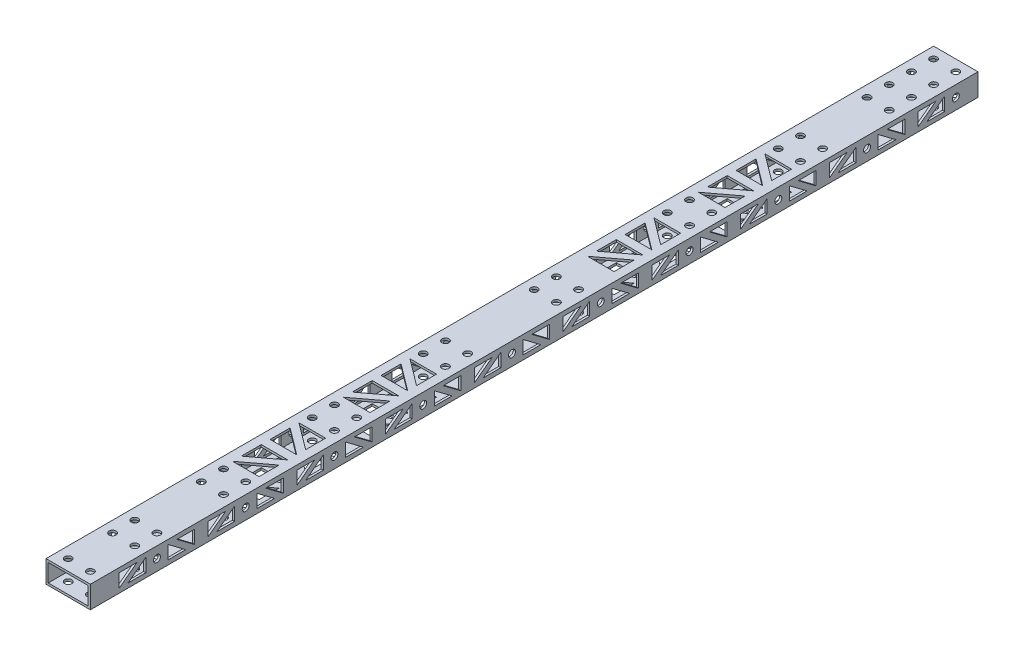
from build123d import *

# Parameters (mm, degrees)
SKETCH_1_W          = 20
SKETCH_1_H          = 10
SKETCH_1_W_2        = 18
SKETCH_1_H_2        = 8
EXTRUDE_1_DEPTH     = 400
SKETCH_2_R          = 1.575
CUT_EXTRUDE_1_DEPTH = 401.62451248
SKETCH_3_R          = 1.575
CUT_EXTRUDE_2_DEPTH = 10
SKETCH_4_R          = 1.575
CUT_EXTRUDE_3_DEPTH = 401.62451248


with BuildPart() as part:
    # 草图1 → 拉伸-薄壁1 (new body)
    with BuildSketch(Plane.XY):
        with Locations((10, -5)):
            Rectangle(SKETCH_1_W, SKETCH_1_H)
        with Locations((10, -5)):
            Rectangle(SKETCH_1_W_2, SKETCH_1_H_2, mode=Mode.SUBTRACT)
    extrude(amount=EXTRUDE_1_DEPTH)

    # 草图2 → 切除-拉伸1 (cut, through all)
    with BuildSketch(Plane(origin=(0, 0, 0), x_dir=(1, 0, 0), z_dir=(0, 1, 0))):
        with Locations(Location((15, -5, 0), (0, 0, 270))):
            Circle(SKETCH_2_R)
        with Locations(Location((5, -5, 0), (0, 0, 90))):
            Circle(SKETCH_2_R)
        with Locations(Location((5, -15, 0), (0, 0, 270))):
            Circle(SKETCH_2_R)
        with Locations(Location((15, -15, 0), (0, 0, 90))):
            Circle(SKETCH_2_R)
        with Locations(Location((15, -25, 0), (0, 0, 270))):
            Circle(SKETCH_2_R)
        with Locations(Location((5, -25, 0), (0, 0, 90))):
            Circle(SKETCH_2_R)
        with Locations(Location((5, -35, 0), (0, 0, 270))):
            Circle(SKETCH_2_R)
        with Locations(Location((15, -35, 0), (0, 0, 90))):
            Circle(SKETCH_2_R)
    extrude(amount=-CUT_EXTRUDE_1_DEPTH, mode=Mode.SUBTRACT)

    # 草图3 → 切除-拉伸2 (cut)
    with BuildSketch(Plane(origin=(0, 0, 0), x_dir=(1, 0, 0), z_dir=(0, 1, 0))):
        with Locations(Location((5, -395, 0), (0, 0, 270))):
            Circle(SKETCH_3_R)
        with Locations(Location((15, -395, 0), (0, 0, 90))):
            Circle(SKETCH_3_R)
        with Locations(Location((5, -375, 0), (0, 0, 270))):
            Circle(SKETCH_3_R)
        with Locations(Location((15, -375, 0), (0, 0, 90))):
            Circle(SKETCH_3_R)
        with Locations(Location((5, -365, 0), (0, 0, 270))):
            Circle(SKETCH_3_R)
        with Locations(Location((15, -365, 0), (0, 0, 90))):
            Circle(SKETCH_3_R)
        with Locations(Location((15, -335, 0), (0, 0, 270))):
            Circle(SKETCH_3_R)
        with Locations(Location((5, -335, 0), (0, 0, 90))):
            Circle(SKETCH_3_R)
        with Locations(Location((15, -325, 0), (0, 0, 270))):
            Circle(SKETCH_3_R)
        with Locations(Location((5, -325, 0), (0, 0, 90))):
            Circle(SKETCH_3_R)
        with Locations(Location((5, -275, 0), (0, 0, 90))):
            Circle(SKETCH_3_R)
        with Locations(Location((15, -275, 0), (0, 0, 270))):
            Circle(SKETCH_3_R)
        with Locations(Location((5, -285, 0), (0, 0, 90))):
            Circle(SKETCH_3_R)
        with Locations(Location((15, -285, 0), (0, 0, 270))):
            Circle(SKETCH_3_R)
        with Locations(Location((5, -225, 0), (0, 0, 90))):
            Circle(SKETCH_3_R)
        with Locations(Location((15, -225, 0), (0, 0, 270))):
            Circle(SKETCH_3_R)
        with Locations(Location((5, -235, 0), (0, 0, 90))):
            Circle(SKETCH_3_R)
        with Locations(Location((15, -235, 0), (0, 0, 270))):
            Circle(SKETCH_3_R)
        with Locations(Location((5, -175, 0), (0, 0, 90))):
            Circle(SKETCH_3_R)
        with Locations(Location((15, -175, 0), (0, 0, 270))):
            Circle(SKETCH_3_R)
        with Locations(Location((5, -185, 0), (0, 0, 90))):
            Circle(SKETCH_3_R)
        with Locations(Location((15, -185, 0), (0, 0, 270))):
            Circle(SKETCH_3_R)
        with Locations(Location((15, -115, 0), (0, 0, 90))):
            Circle(SKETCH_3_R)
        with Locations(Location((5, -115, 0), (0, 0, 270))):
            Circle(SKETCH_3_R)
        with Locations(Location((15, -125, 0), (0, 0, 90))):
            Circle(SKETCH_3_R)
        with Locations(Location((5, -125, 0), (0, 0, 270))):
            Circle(SKETCH_3_R)
        with Locations(Location((5, -75, 0), (0, 0, 270))):
            Circle(SKETCH_3_R)
        with Locations(Location((15, -75, 0), (0, 0, 90))):
            Circle(SKETCH_3_R)
        with Locations(Location((5, -65, 0), (0, 0, 270))):
            Circle(SKETCH_3_R)
        with Locations(Location((15, -65, 0), (0, 0, 90))):
            Circle(SKETCH_3_R)
        Polygon((4, -320), (16, -320), (16, -311), align=None)
        Polygon((4, -307), (4, -316), (16, -307), align=None)
        Polygon((16, -303), (4, -303), (4, -294), align=None)
        Polygon((16, -299), (4, -290), (16, -290), align=None)
        Polygon((4, -240), (16, -240), (16, -249), align=None)
        Polygon((4, -253), (4, -244), (16, -253), align=None)
        Polygon((16, -257), (4, -257), (4, -266), align=None)
        Polygon((16, -261), (4, -270), (16, -270), align=None)
        Polygon((4, -110), (16, -110), (16, -101), align=None)
        Polygon((4, -97), (4, -106), (16, -97), align=None)
        Polygon((16, -93), (4, -93), (4, -84), align=None)
        Polygon((16, -89), (4, -80), (16, -80), align=None)
        Polygon((4, -130), (16, -130), (16, -139), align=None)
        Polygon((4, -134), (16, -143), (4, -143), align=None)
        Polygon((16, -147), (4, -147), (4, -156), align=None)
        Polygon((16, -151), (4, -160), (16, -160), align=None)
    extrude(amount=-CUT_EXTRUDE_2_DEPTH, mode=Mode.SUBTRACT)

    # 草图4 → 切除-拉伸3 (cut, through all)
    with BuildSketch(Plane.ZY):
        with Locations(Location((10, -5, 0), (0, 0, 270))):
            Circle(SKETCH_4_R)
        with Locations(Location((50, -5, 0), (0, 0, 270))):
            Circle(SKETCH_4_R)
        with Locations(Location((90, -5, 0), (0, 0, 270))):
            Circle(SKETCH_4_R)
        with Locations(Location((130, -5, 0), (0, 0, 270))):
            Circle(SKETCH_4_R)
        with Locations(Location((170, -5, 0), (0, 0, 270))):
            Circle(SKETCH_4_R)
        with Locations(Location((210, -5, 0), (0, 0, 270))):
            Circle(SKETCH_4_R)
        with Locations(Location((250, -5, 0), (0, 0, 270))):
            Circle(SKETCH_4_R)
        with Locations(Location((290, -5, 0), (0, 0, 270))):
            Circle(SKETCH_4_R)
        with Locations(Location((330, -5, 0), (0, 0, 270))):
            Circle(SKETCH_4_R)
        with Locations(Location((370, -5, 0), (0, 0, 270))):
            Circle(SKETCH_4_R)
        Polygon((15, -2), (15, -8), (23, -8), align=None)
        Polygon((19, -2), (27, -8), (27, -2), align=None)
        Polygon((63, -8), (55, -2), (55, -8), align=None)
        Polygon((67, -2), (59, -2), (67, -8), align=None)
        Polygon((103, -8), (95, -2), (95, -8), align=None)
        Polygon((107, -2), (99, -2), (107, -8), align=None)
        Polygon((143, -8), (135, -2), (135, -8), align=None)
        Polygon((147, -2), (139, -2), (147, -8), align=None)
        Polygon((183, -8), (175, -2), (175, -8), align=None)
        Polygon((187, -2), (179, -2), (187, -8), align=None)
        Polygon((223, -8), (215, -2), (215, -8), align=None)
        Polygon((227, -2), (219, -2), (227, -8), align=None)
        Polygon((263, -8), (255, -2), (255, -8), align=None)
        Polygon((267, -2), (259, -2), (267, -8), align=None)
        Polygon((303, -8), (295, -2), (295, -8), align=None)
        Polygon((307, -2), (299, -2), (307, -8), align=None)
        Polygon((343, -8), (335, -2), (335, -8), align=None)
        Polygon((347, -2), (339, -2), (347, -8), align=None)
        Polygon((383, -8), (375, -2), (375, -8), align=None)
        Polygon((387, -2), (379, -2), (387, -8), align=None)
        Polygon((33, -2), (41, -2), (33, -8), align=None)
        Polygon((37, -8), (45, -2), (45, -8), align=None)
        Polygon((73, -2), (81, -2), (73, -8), align=None)
        Polygon((77, -8), (85, -2), (85, -8), align=None)
        Polygon((113, -2), (121, -2), (113, -8), align=None)
        Polygon((117, -8), (125, -2), (125, -8), align=None)
        Polygon((153, -2), (161, -2), (153, -8), align=None)
        Polygon((157, -8), (165, -2), (165, -8), align=None)
        Polygon((193, -2), (201, -2), (193, -8), align=None)
        Polygon((197, -8), (205, -2), (205, -8), align=None)
        Polygon((233, -2), (241, -2), (233, -8), align=None)
        Polygon((237, -8), (245, -2), (245, -8), align=None)
        Polygon((273, -2), (281, -2), (273, -8), align=None)
        Polygon((277, -8), (285, -2), (285, -8), align=None)
        Polygon((313, -2), (321, -2), (313, -8), align=None)
        Polygon((317, -8), (325, -2), (325, -8), align=None)
        Polygon((353, -2), (361, -2), (353, -8), align=None)
        Polygon((357, -8), (365, -2), (365, -8), align=None)
    extrude(amount=-CUT_EXTRUDE_3_DEPTH, mode=Mode.SUBTRACT)


solid = part.part
